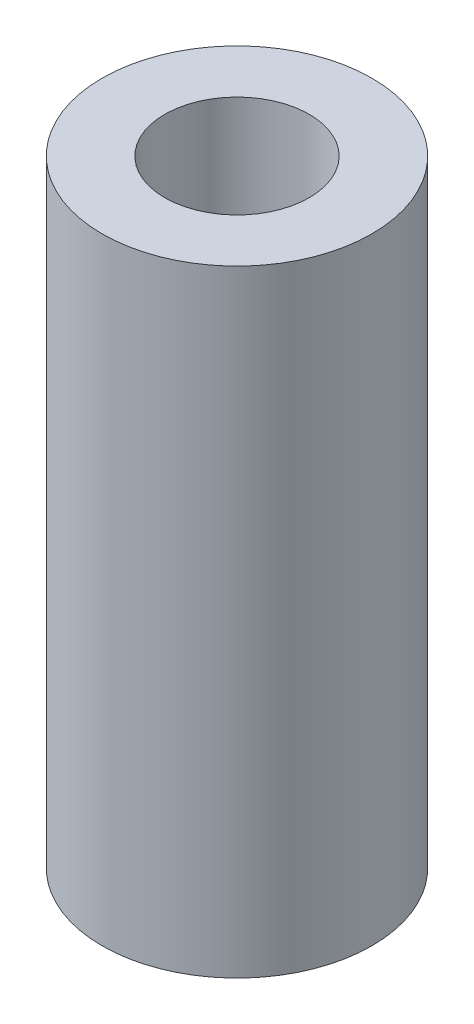
from build123d import *

# Parameters (mm, degrees)
CROQUIS1_R              = 3.5
CROQUIS1_R_2            = 1.875
SALIENTE_EXTRUIR1_DEPTH = 16


with BuildPart() as part:
    # Croquis1 → Saliente-Extruir1 (new body)
    with BuildSketch(Plane(origin=(0, 0, 0), x_dir=(1, 0, 0), z_dir=(0, 1, 0))):
        with Locations(Location((0, 0, 0), (0, 0, 270))):
            Circle(CROQUIS1_R)
        with Locations(Location((0, 0, 0), (0, 0, 270))):
            Circle(CROQUIS1_R_2, mode=Mode.SUBTRACT)
    extrude(amount=SALIENTE_EXTRUIR1_DEPTH)


solid = part.part
